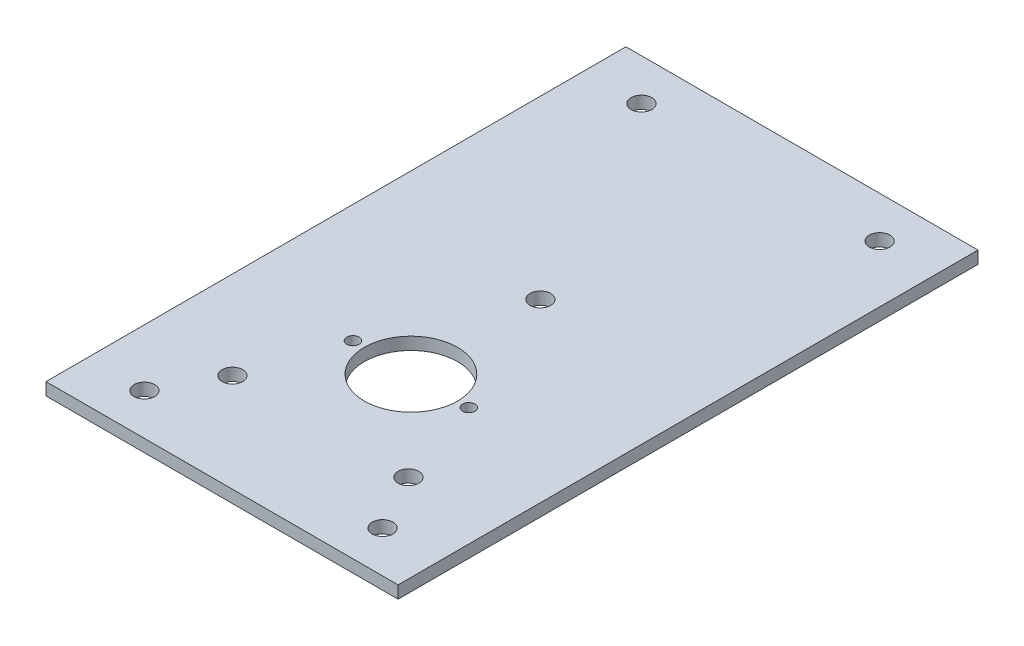
from build123d import *

# Parameters (mm, degrees)
SKETCH1_W           = 170
SKETCH1_H           = 280
BOSS_EXTRUDE1_DEPTH = 6
SKETCH2_R           = 5
CUT_EXTRUDE1_DEPTH  = 6
SKETCH4_R           = 22.5
SKETCH4_R_2         = 3
CUT_EXTRUDE3_DEPTH  = 10


with BuildPart() as part:
    # Sketch1 → Boss-Extrude1 (new body)
    with BuildSketch(Plane(origin=(0, 0, 0), x_dir=(1, 0, 0), z_dir=(0, 1, 0))):
        Rectangle(SKETCH1_W, SKETCH1_H)
    extrude(amount=BOSS_EXTRUDE1_DEPTH)

    # Sketch2 → Cut-Extrude1 (cut)
    with BuildSketch(Plane(origin=(0, 6, 0), x_dir=(1, 0, 0), z_dir=(0, 1, 0))):
        with Locations((-57.5, 120)):
            Circle(SKETCH2_R)
        with Locations((57.5, 120)):
            Circle(SKETCH2_R)
        with Locations((0, 13.7)):
            Circle(SKETCH2_R)
        with Locations((-57.5, -120)):
            Circle(SKETCH2_R)
        with Locations((57.5, -120)):
            Circle(SKETCH2_R)
        with Locations((-42.5, -92.5)):
            Circle(SKETCH2_R)
        with Locations((42.5, -92.5)):
            Circle(SKETCH2_R)
    extrude(amount=-CUT_EXTRUDE1_DEPTH, mode=Mode.SUBTRACT)

    # Sketch4 → Cut-Extrude3 (cut)
    with BuildSketch(Plane(origin=(0, 6, 0), x_dir=(1, 0, 0), z_dir=(0, 1, 0))):
        with Locations((0, -48.8)):
            Circle(SKETCH4_R)
        with Locations((28, -48.8)):
            Circle(SKETCH4_R_2)
        with Locations((-28, -48.8)):
            Circle(SKETCH4_R_2)
    extrude(amount=-CUT_EXTRUDE3_DEPTH, mode=Mode.SUBTRACT)


solid = part.part
